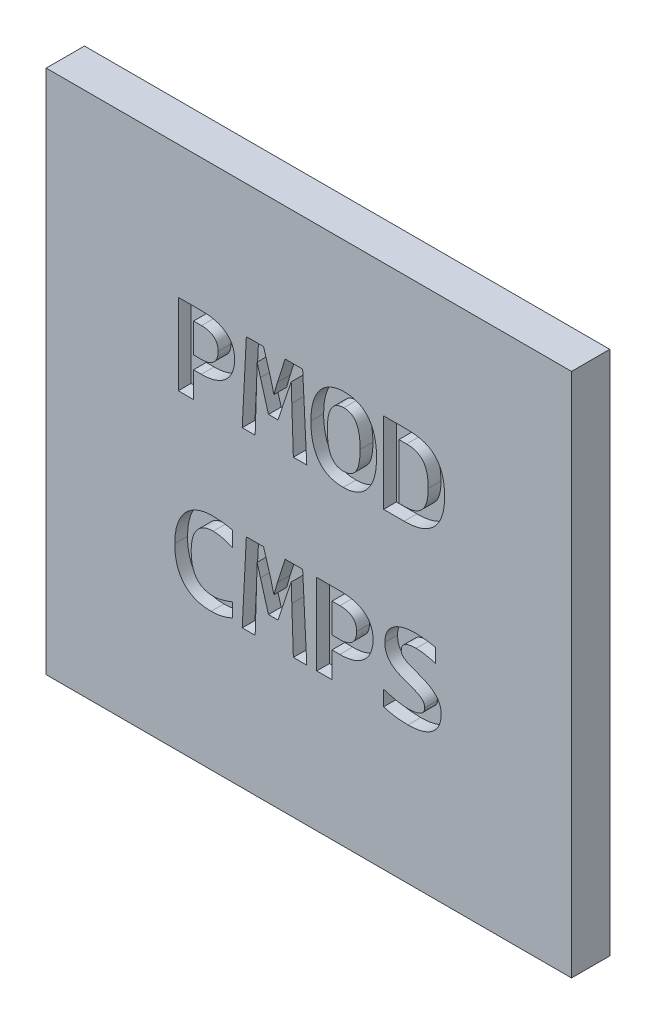
from build123d import *

# Parameters (mm, degrees)
SKETCH1_W           = 20.6
SKETCH1_H           = 20.6
BOSS_EXTRUDE1_DEPTH = 1.5
CUT_EXTRUDE1_DEPTH  = 0.5


with BuildPart() as part:
    # Sketch1 → Boss-Extrude1 (new body)
    with BuildSketch(Plane.XY):
        Rectangle(SKETCH1_W, SKETCH1_H)
    extrude(amount=BOSS_EXTRUDE1_DEPTH)

    # Sketch2 → Cut-Extrude1 (cut)
    # profile 1 of 8: a face of its own
    with BuildSketch(Plane.XY.offset(1.5)):
        with BuildLine():
            add(Edge.make_bspline(
                [(-2.912509351, 4.09115509), (-2.913370286, 4.050356398), (-2.915063486, 3.970117682), (-2.931577289, 3.852461334), (-2.957182348, 3.73942017), (-2.993980807, 3.631541868), (-3.040457289, 3.529506134), (-3.097062839, 3.434053925), (-3.164284862, 3.34614098), (-3.241547607, 3.265227882), (-3.328971358, 3.192191404), (-3.426972654, 3.128206505), (-3.534358037, 3.071727101), (-3.652134839, 3.025487032), (-3.779142916, 2.987319721), (-3.916666916, 2.962736718), (-4.063614226, 2.945105044), (-4.165147733, 2.943682505), (-4.217451606, 2.9429497)],
                knots=[0, 0, 0, 0, 0.995951848, 1.958736758, 2.895894734, 3.823294688, 4.737446986, 5.629902, 6.527868647, 7.434569106, 8.357172052, 9.30367983, 10.2881434, 11.315342456, 12.38959799, 13.521565949, 14.723261872, 16, 16, 16, 16], degree=3))
            Line((-4.217451606, 2.9429497), (-4.523016597, 2.9429497))
            Line((-4.523016597, 2.9429497), (-4.523016597, 1.93063086))
            Line((-4.523016597, 1.93063086), (-5.121205003, 1.93063086))
            Line((-5.121205003, 1.93063086), (-5.121205003, 5.10563086))
            Line((-5.121205003, 5.10563086), (-4.188692548, 5.10563086))
            add(Edge.make_bspline(
                [(-4.188692548, 5.10563086), (-4.138582372, 5.1047663), (-4.041321914, 5.103088249), (-3.89973554, 5.091182061), (-3.767398311, 5.069537545), (-3.643812671, 5.040186763), (-3.529162401, 5.00307623), (-3.424004781, 4.957775118), (-3.327838708, 4.905336836), (-3.24212565, 4.843751877), (-3.165274088, 4.77542748), (-3.09844419, 4.69907125), (-3.041398636, 4.615339112), (-2.994428709, 4.524037447), (-2.957700564, 4.425543399), (-2.931221289, 4.320213907), (-2.915030478, 4.207892453), (-2.913364563, 4.130754509), (-2.912509351, 4.09115509)],
                knots=[0, 0, 0, 0, 1.300129117, 2.523462549, 3.682710143, 4.776150495, 5.816367536, 6.80513186, 7.743083921, 8.652423492, 9.537522282, 10.405594958, 11.278287675, 12.15988475, 13.063059235, 13.999608658, 14.973082093, 16, 16, 16, 16], degree=3))
        make_face()
        with BuildLine():
            add(Edge.make_bspline(
                [(-3.556712249, 4.049454456), (-3.556964785, 4.069860158), (-3.557460031, 4.109877573), (-3.566115221, 4.168223855), (-3.577697613, 4.22409282), (-3.596004733, 4.276434461), (-3.618449919, 4.325841445), (-3.645160019, 4.372220135), (-3.679395985, 4.413106743), (-3.716466152, 4.451958644), (-3.760064446, 4.485645495), (-3.80874453, 4.515038392), (-3.862076617, 4.541494747), (-3.921543138, 4.561575839), (-3.985934275, 4.579481568), (-4.056292118, 4.591129101), (-4.132449972, 4.598554233), (-4.185078077, 4.599157854), (-4.212418771, 4.59947144)],
                knots=[0, 0, 0, 0, 1.004563121, 1.970038524, 2.901389421, 3.812754521, 4.695426961, 5.574536234, 6.43964924, 7.316613662, 8.216812953, 9.144562093, 10.116517752, 11.143806295, 12.232537793, 13.407305454, 14.653075798, 16, 16, 16, 16], degree=3))
            Line((-4.212418771, 4.59947144), (-4.523016597, 4.59947144))
            Line((-4.523016597, 4.59947144), (-4.523016597, 3.449109121))
            Line((-4.523016597, 3.449109121), (-4.193006407, 3.449109121))
            add(Edge.make_bspline(
                [(-4.193006407, 3.449109121), (-4.168059906, 3.449682742), (-4.119475983, 3.450799883), (-4.048788035, 3.458840753), (-3.9826058, 3.471579517), (-3.920782753, 3.489414442), (-3.864084495, 3.513261293), (-3.811898761, 3.541537894), (-3.763924925, 3.573711347), (-3.721432349, 3.611644614), (-3.683210878, 3.653223714), (-3.649913267, 3.699161409), (-3.620889941, 3.748536549), (-3.598260671, 3.802451889), (-3.579053014, 3.859228155), (-3.566627125, 3.919855077), (-3.558382997, 3.98356205), (-3.557278083, 4.02713862), (-3.556712249, 4.049454456)],
                knots=[0, 0, 0, 0, 1.207684678, 2.35199558, 3.439783558, 4.46788048, 5.461342384, 6.411506493, 7.338429375, 8.251005458, 9.162695831, 10.067864519, 10.993333631, 11.928859732, 12.893928183, 13.890772671, 14.919851382, 16, 16, 16, 16], degree=3))
        make_face(mode=Mode.SUBTRACT)
    # profile 2 of 8: a face of its own
    with BuildSketch(Plane.XY.offset(1.5)):
        Polygon((-0.608908807, 1.93063086), (-0.669302829, 3.730228912), (-0.692310075, 4.448486385), (-0.849046941, 3.990498387), (-1.210692095, 2.896935208), (-1.584559849, 2.896935208), (-1.898752557, 3.990498387), (-2.030325247, 4.448486385), (-2.049018635, 3.744608441), (-2.106536751, 1.93063086), (-2.613415148, 1.93063086), (-2.452364423, 5.10563086), (-1.777964514, 5.10563086), (-1.502596534, 4.191092816), (-1.371023843, 3.675586702), (-1.232980365, 4.161614782), (-0.93029128, 5.10563086), (-0.243668771, 5.10563086), (-0.082618046, 1.93063086), align=None)
    # profile 3 of 8: a face of its own
    with BuildSketch(Plane.XY.offset(1.5)):
        with BuildLine():
            add(Edge.make_bspline(
                [(2.655244273, 3.532510389), (2.654006971, 3.463208905), (2.651617448, 3.329371248), (2.633215003, 3.13577299), (2.601105268, 2.957090484), (2.556549013, 2.793076091), (2.501179835, 2.643738733), (2.436337795, 2.507975393), (2.361744164, 2.385998817), (2.277207333, 2.277938407), (2.1835727, 2.184241701), (2.083576471, 2.101899685), (1.974461879, 2.034083532), (1.858690431, 1.978735298), (1.737079924, 1.936256016), (1.61064822, 1.907327057), (1.480588115, 1.887408834), (1.392078402, 1.885552746), (1.347426111, 1.884616367)],
                knots=[0, 0, 0, 0, 1.399094986, 2.701985343, 3.921606295, 5.060250114, 6.128937938, 7.133140352, 8.093336986, 9.010033534, 9.896223585, 10.76303321, 11.619598843, 12.483160966, 13.349322064, 14.214333538, 15.099148625, 16, 16, 16, 16], degree=3))
            add(Edge.make_bspline(
                [(1.347426111, 1.884616367), (1.296312288, 1.885773477), (1.197049657, 1.888020576), (1.053005714, 1.907846918), (0.91863449, 1.939798961), (0.793970756, 1.985137452), (0.679290009, 2.043880799), (0.57421162, 2.115353442), (0.47929809, 2.200484269), (0.394169791, 2.298085665), (0.319090976, 2.408235276), (0.254519443, 2.530425925), (0.199657945, 2.664317883), (0.155851739, 2.809920605), (0.120046473, 2.966672796), (0.096706882, 3.135315298), (0.080993218, 3.315560919), (0.079303817, 3.439725838), (0.078432678, 3.503751331)],
                knots=[0, 0, 0, 0, 1.046182631, 2.031678192, 2.97076483, 3.86965419, 4.740954983, 5.602542005, 6.464464361, 7.344346083, 8.248138063, 9.187737429, 10.169205071, 11.206116273, 12.297806163, 13.458167033, 14.68930686, 16, 16, 16, 16], degree=3))
            add(Edge.make_bspline(
                [(0.078432678, 3.503751331), (0.079651524, 3.573055667), (0.082005406, 3.706898833), (0.100629108, 3.900181438), (0.131808137, 4.078725402), (0.176199678, 4.242647511), (0.232857607, 4.391796166), (0.297084584, 4.528164365), (0.371967564, 4.65024838), (0.456462745, 4.758323057), (0.550099136, 4.852034108), (0.650126803, 4.934307471), (0.759028147, 5.002326277), (0.875172585, 5.056679528), (0.996889098, 5.099249292), (1.12319788, 5.12897738), (1.253329784, 5.148857997), (1.341599743, 5.150709019), (1.38625084, 5.151645353)],
                knots=[0, 0, 0, 0, 1.399147349, 2.702086469, 3.916134137, 5.054820572, 6.125245074, 7.133847534, 8.094080105, 9.010810961, 9.897034179, 10.763876246, 11.620473937, 12.481991629, 13.348185144, 14.219056267, 15.099114909, 16, 16, 16, 16], degree=3))
            add(Edge.make_bspline(
                [(1.38625084, 5.151645353), (1.437364407, 5.150487868), (1.536626542, 5.148240041), (1.680673989, 5.128418835), (1.81503284, 5.096448658), (1.939740023, 5.051173844), (2.054145385, 4.992264558), (2.159693248, 4.921722472), (2.254337576, 4.836442266), (2.339543145, 4.738922864), (2.414360992, 4.628862885), (2.479378338, 4.507148999), (2.53382312, 4.373553373), (2.578079946, 4.228091533), (2.613581701, 4.071006831), (2.636981368, 3.90166703), (2.65265814, 3.720937382), (2.654365543, 3.596535102), (2.655244273, 3.532510389)],
                knots=[0, 0, 0, 0, 1.04600235, 2.031328089, 2.970252902, 3.868987364, 4.740138012, 5.59881955, 6.460593378, 7.340323477, 8.243959714, 9.179069388, 10.160367901, 11.192410958, 12.288699193, 13.453715767, 14.689532722, 16, 16, 16, 16], degree=3))
        make_face()
        with BuildLine():
            add(Edge.make_bspline(
                [(2.011041374, 3.503751331), (2.010730344, 3.548340029), (2.010127908, 3.634704133), (2.002587562, 3.75988876), (1.991619204, 3.876322708), (1.975199383, 3.983905304), (1.953686604, 4.082577993), (1.927904787, 4.172690034), (1.898268628, 4.25437226), (1.862546829, 4.326955072), (1.822848384, 4.391833704), (1.775240984, 4.447305549), (1.721664386, 4.493999212), (1.663037783, 4.533873017), (1.597232604, 4.563367903), (1.52551661, 4.583809012), (1.448101034, 4.597251349), (1.394457883, 4.598716878), (1.366838476, 4.59947144)],
                knots=[0, 0, 0, 0, 1.486095503, 2.8784268, 4.178896477, 5.383313849, 6.50370181, 7.542880676, 8.505944191, 9.395566462, 10.23559869, 11.034510805, 11.821349203, 12.599050339, 13.389126436, 14.213243526, 15.080047443, 16, 16, 16, 16], degree=3))
            add(Edge.make_bspline(
                [(1.366838476, 4.59947144), (1.339226129, 4.598694576), (1.285833118, 4.597192381), (1.208639611, 4.58415821), (1.137718143, 4.561919829), (1.073139937, 4.530751299), (1.014558072, 4.491248333), (0.961927298, 4.4432401), (0.914003646, 4.387294442), (0.871687619, 4.322984951), (0.834903717, 4.250599053), (0.804500403, 4.170060803), (0.777536023, 4.082319562), (0.757307353, 3.986480587), (0.741395916, 3.88350739), (0.731310152, 3.773035791), (0.723509595, 3.655325973), (0.722932444, 3.57422567), (0.722635577, 3.532510389)],
                knots=[0, 0, 0, 0, 0.940493395, 1.818598556, 2.65806311, 3.465325826, 4.253609174, 5.057352584, 5.885618443, 6.757702066, 7.674492596, 8.646685703, 9.687886232, 10.799631583, 11.981266591, 13.236822997, 14.578714251, 16, 16, 16, 16], degree=3))
            add(Edge.make_bspline(
                [(0.722635577, 3.532510389), (0.722970633, 3.487923917), (0.723619604, 3.401564128), (0.730836336, 3.276325119), (0.74292184, 3.159970313), (0.759465111, 3.052225187), (0.779804501, 2.953135665), (0.805376857, 2.862830178), (0.836761785, 2.781792762), (0.871187136, 2.70853793), (0.912832798, 2.644478754), (0.959583814, 2.58855348), (1.012670058, 2.54100366), (1.072232213, 2.502741328), (1.137625208, 2.472944967), (1.208877408, 2.452453432), (1.28580576, 2.438966109), (1.339216803, 2.437531956), (1.366838476, 2.43679028)],
                knots=[0, 0, 0, 0, 1.486662466, 2.879524953, 4.181300558, 5.38617743, 6.513130284, 7.552705609, 8.511484829, 9.408629925, 10.246547046, 11.051854149, 11.833006184, 12.613299248, 13.403676768, 14.220441868, 15.079696471, 16, 16, 16, 16], degree=3))
            add(Edge.make_bspline(
                [(1.366838476, 2.43679028), (1.394444582, 2.437591867), (1.4480619, 2.43914873), (1.525570905, 2.451932253), (1.596452366, 2.474562746), (1.661818967, 2.504687771), (1.720227178, 2.545182992), (1.773936477, 2.592508058), (1.82102363, 2.649092978), (1.862850943, 2.713248423), (1.89835764, 2.786045201), (1.930431417, 2.865536739), (1.954949799, 2.953750323), (1.975948114, 3.049233744), (1.991207465, 3.152588487), (2.002672082, 3.26316717), (2.010083094, 3.380945261), (2.010715887, 3.462039281), (2.011041374, 3.503751331)],
                knots=[0, 0, 0, 0, 0.940029382, 1.82575022, 2.664800606, 3.468147471, 4.267377886, 5.076798435, 5.899366548, 6.766536204, 7.679194691, 8.653886611, 9.682108903, 10.79330575, 11.982426563, 13.238186273, 14.579415474, 16, 16, 16, 16], degree=3))
        make_face(mode=Mode.SUBTRACT)
    # profile 4 of 8: a face of its own
    with BuildSketch(Plane.XY.offset(1.5)):
        with BuildLine():
            add(Edge.make_bspline(
                [(5.324084852, 3.558393541), (5.323061463, 3.498190937), (5.321059209, 3.380404881), (5.303016709, 3.207981482), (5.275962761, 3.043798182), (5.235370702, 2.888728295), (5.184214305, 2.743206366), (5.120119976, 2.607988643), (5.041776688, 2.484658251), (4.951860536, 2.371562298), (4.848077612, 2.270685515), (4.730372164, 2.182588655), (4.599421608, 2.106114714), (4.45486354, 2.041966355), (4.296040993, 1.99145556), (4.122525189, 1.956149995), (3.934139655, 1.934362242), (3.803512083, 1.931903917), (3.735865876, 1.93063086)],
                knots=[0, 0, 0, 0, 1.110427075, 2.172544315, 3.195349749, 4.177748535, 5.125988168, 6.037741059, 6.932042727, 7.815964876, 8.69777207, 9.594508137, 10.521994162, 11.48995721, 12.506588634, 13.59059811, 14.752277985, 16, 16, 16, 16], degree=3))
            Line((3.735865876, 1.93063086), (2.931331229, 1.93063086))
            Line((2.931331229, 1.93063086), (2.931331229, 5.10563086))
            Line((2.931331229, 5.10563086), (3.869595495, 5.10563086))
            add(Edge.make_bspline(
                [(3.869595495, 5.10563086), (3.928362709, 5.104631119), (4.042330699, 5.102692308), (4.207612222, 5.084777082), (4.361851113, 5.057849253), (4.504584802, 5.017226438), (4.636021863, 4.965579706), (4.757010671, 4.90244833), (4.865177751, 4.824733959), (4.962462955, 4.735449726), (5.049214699, 4.634195834), (5.122109591, 4.51852919), (5.185268903, 4.391240016), (5.235754816, 4.250658712), (5.276532132, 4.097319866), (5.303359885, 3.92990398), (5.321193525, 3.748829099), (5.323098057, 3.623388202), (5.324084852, 3.558393541)],
                knots=[0, 0, 0, 0, 1.153278946, 2.236568238, 3.259968389, 4.223524422, 5.144358991, 6.028301925, 6.89516473, 7.750925641, 8.615384892, 9.504135122, 10.427813762, 11.399741143, 12.431359603, 13.538177242, 14.724456375, 16, 16, 16, 16], degree=3))
        make_face()
        with BuildLine():
            add(Edge.make_bspline(
                [(4.679881954, 3.519568813), (4.679216419, 3.561037321), (4.677918971, 3.641879505), (4.67114753, 3.759751859), (4.658115991, 3.870615215), (4.640360236, 3.974404749), (4.617301694, 4.071475236), (4.585612735, 4.160485346), (4.547316614, 4.242045431), (4.502031168, 4.316036825), (4.448594925, 4.382044289), (4.386587353, 4.439582331), (4.316411355, 4.488622968), (4.237666637, 4.529371678), (4.149646978, 4.560950915), (4.052219328, 4.583668247), (3.944763129, 4.597460834), (3.869878791, 4.598781649), (3.830770767, 4.59947144)],
                knots=[0, 0, 0, 0, 1.255554051, 2.44768226, 3.572651082, 4.633086061, 5.634384971, 6.589040905, 7.488061995, 8.357917203, 9.208928104, 10.050890238, 10.910395455, 11.793077134, 12.727247796, 13.733895114, 14.81653645, 16, 16, 16, 16], degree=3))
            Line((3.830770767, 4.59947144), (3.529519635, 4.59947144))
            Line((3.529519635, 4.59947144), (3.529519635, 2.43679028))
            Line((3.529519635, 2.43679028), (3.78978911, 2.43679028))
            add(Edge.make_bspline(
                [(3.78978911, 2.43679028), (3.825058221, 2.437616247), (3.893659637, 2.439222823), (3.993254594, 2.451720687), (4.086632992, 2.471380608), (4.173319963, 2.500397049), (4.253597776, 2.536884363), (4.327185431, 2.582112499), (4.394242715, 2.635293679), (4.45444761, 2.69725702), (4.50848719, 2.767575353), (4.553863311, 2.848119096), (4.594039987, 2.936875458), (4.625027653, 3.035778756), (4.650405437, 3.143357977), (4.66689669, 3.26081339), (4.678050429, 3.387060837), (4.679258824, 3.474486296), (4.679881954, 3.519568813)],
                knots=[0, 0, 0, 0, 1.054031268, 2.050180318, 2.995897094, 3.902119281, 4.777280808, 5.626335315, 6.477804485, 7.328942045, 8.203017891, 9.120973329, 10.086270126, 11.110341295, 12.2138552, 13.387141734, 14.65263243, 16, 16, 16, 16], degree=3))
        make_face(mode=Mode.SUBTRACT)
    # profile 5 of 8: a face of its own
    with BuildSketch(Plane.XY.offset(1.5)):
        with BuildLine():
            add(Edge.make_bspline(
                [(-3.004538336, -4.729151749), (-3.039625175, -4.744129865), (-3.108464475, -4.77351647), (-3.212514945, -4.810775426), (-3.314666346, -4.842612079), (-3.415893974, -4.868656677), (-3.517310518, -4.88940034), (-3.620207657, -4.902372417), (-3.725022317, -4.911688822), (-3.795630639, -4.912698688), (-3.831361253, -4.91320972)],
                knots=[0, 0, 0, 0, 1.072602722, 2.104413604, 3.106297595, 4.08050826, 5.042709706, 6.014913564, 6.995467464, 8, 8, 8, 8], degree=3))
            add(Edge.make_bspline(
                [(-3.831361253, -4.91320972), (-3.887255583, -4.911986365), (-3.995777276, -4.90961116), (-4.153901359, -4.890660719), (-4.301970782, -4.859353509), (-4.44050999, -4.81564768), (-4.568492366, -4.75854102), (-4.686526041, -4.689210778), (-4.794388482, -4.607641448), (-4.891331835, -4.513390478), (-4.977526213, -4.407113638), (-5.051564655, -4.287853535), (-5.115759189, -4.157462077), (-5.168209549, -4.014769458), (-5.209022972, -3.860195327), (-5.23794179, -3.693742577), (-5.256429614, -3.515456711), (-5.258289668, -3.392622621), (-5.259248481, -3.329304602)],
                knots=[0, 0, 0, 0, 1.102605573, 2.140764961, 3.136846793, 4.08496906, 5.001529512, 5.896051515, 6.780328523, 7.66316301, 8.557497515, 9.473264751, 10.427030373, 11.420482266, 12.467702166, 13.577100782, 14.751053738, 16, 16, 16, 16], degree=3))
            add(Edge.make_bspline(
                [(-5.259248481, -3.329304602), (-5.258098137, -3.264301195), (-5.255855697, -3.137585796), (-5.235805739, -2.953306496), (-5.205091981, -2.77963151), (-5.159321648, -2.617714211), (-5.103021056, -2.466757899), (-5.034280148, -2.328349609), (-4.955989706, -2.201219352), (-4.865504873, -2.087098021), (-4.764602816, -1.98513347), (-4.652881485, -1.896262696), (-4.531703598, -1.819395407), (-4.39969912, -1.756814525), (-4.258675106, -1.707421675), (-4.108974788, -1.671127265), (-3.950580218, -1.650327605), (-3.842206542, -1.647583869), (-3.786784713, -1.646180734)],
                knots=[0, 0, 0, 0, 1.232307787, 2.402218284, 3.511138658, 4.573037126, 5.588482404, 6.562047137, 7.499038646, 8.414657469, 9.317692522, 10.213424542, 11.116219401, 12.033010505, 12.977368732, 13.94518829, 14.949178196, 16, 16, 16, 16], degree=3))
            add(Edge.make_bspline(
                [(-3.786784713, -1.646180734), (-3.751308801, -1.646148563), (-3.682493509, -1.646086159), (-3.581860312, -1.650486746), (-3.485338877, -1.654399448), (-3.390982014, -1.664741945), (-3.296790434, -1.676115688), (-3.201649345, -1.693896685), (-3.103599168, -1.71212174), (-3.037995599, -1.729398645), (-3.004538336, -1.73820972)],
                knots=[0, 0, 0, 0, 1.077376558, 2.089868288, 3.059369192, 4.010411707, 4.972009834, 5.940198088, 6.949518525, 8, 8, 8, 8], degree=3))
            Line((-3.004538336, -1.73820972), (-3.004538336, -2.336398126))
            add(Edge.make_bspline(
                [(-3.004538336, -2.336398126), (-3.038877214, -2.320651479), (-3.10611785, -2.2898172), (-3.207897791, -2.251387491), (-3.306693917, -2.218351547), (-3.403317097, -2.194485824), (-3.495879638, -2.175472048), (-3.584726001, -2.162642845), (-3.669193872, -2.15430181), (-3.724216209, -2.15297976), (-3.75083589, -2.152340155)],
                knots=[0, 0, 0, 0, 1.170030163, 2.291093263, 3.368831198, 4.395296508, 5.372370687, 6.295361994, 7.175300008, 8, 8, 8, 8], degree=3))
            add(Edge.make_bspline(
                [(-3.75083589, -2.152340155), (-3.787796523, -2.153242899), (-3.85917287, -2.154986231), (-3.962255306, -2.170150483), (-4.056991334, -2.195803994), (-4.143266199, -2.232142593), (-4.221794588, -2.277309234), (-4.293473153, -2.330420165), (-4.357019889, -2.393016916), (-4.413274831, -2.463124999), (-4.462459627, -2.540889456), (-4.504668334, -2.625740183), (-4.540115347, -2.717677009), (-4.567626336, -2.816273776), (-4.589209408, -2.920546606), (-4.603864347, -3.03012214), (-4.613691823, -3.144587495), (-4.614588347, -3.222634894), (-4.615045582, -3.262439792)],
                knots=[0, 0, 0, 0, 1.109729706, 2.143049175, 3.121026665, 4.050204485, 4.946654748, 5.836403406, 6.722153568, 7.618170183, 8.530804457, 9.480502004, 10.460411604, 11.48580219, 12.551706219, 13.656287425, 14.804684813, 16, 16, 16, 16], degree=3))
            add(Edge.make_bspline(
                [(-4.615045582, -3.262439792), (-4.614685238, -3.304408604), (-4.613981956, -3.386318728), (-4.602967756, -3.505492612), (-4.588841054, -3.618328061), (-4.566404181, -3.723783285), (-4.538128464, -3.82217773), (-4.501772241, -3.912491572), (-4.459686763, -3.99577519), (-4.409724328, -4.071029935), (-4.352835556, -4.138717778), (-4.287625476, -4.196991535), (-4.215485458, -4.247271686), (-4.135998951, -4.289300817), (-4.048413257, -4.32155119), (-3.953304149, -4.344170648), (-3.850770379, -4.359190303), (-3.779651677, -4.360407346), (-3.742927149, -4.361035807)],
                knots=[0, 0, 0, 0, 1.256876421, 2.453033611, 3.583260076, 4.661975506, 5.679853963, 6.646528144, 7.574590913, 8.470745685, 9.346915849, 10.216322401, 11.082788599, 11.975686973, 12.902638023, 13.870910894, 14.900573425, 16, 16, 16, 16], degree=3))
            add(Edge.make_bspline(
                [(-3.742927149, -4.361035807), (-3.71461084, -4.360345382), (-3.655605136, -4.35890667), (-3.564658327, -4.346390898), (-3.470021787, -4.328535987), (-3.373261076, -4.306306782), (-3.276836379, -4.279103988), (-3.181972943, -4.247555534), (-3.091109498, -4.213636339), (-3.032738067, -4.188918994), (-3.004538336, -4.176977836)],
                knots=[0, 0, 0, 0, 0.887372101, 1.849111607, 2.873273884, 3.906654629, 4.960374994, 6.012916101, 7.040022999, 8, 8, 8, 8], degree=3))
            Line((-3.004538336, -4.176977836), (-3.004538336, -4.729151749))
        make_face()
    # profile 6 of 8: a face of its own
    with BuildSketch(Plane.XY.offset(1.5)):
        Polygon((-0.608908807, -4.867195227), (-0.669302829, -3.067597175), (-0.692310075, -2.349339702), (-0.849046941, -2.8073277), (-1.210692095, -3.900890879), (-1.584559849, -3.900890879), (-1.898752557, -2.8073277), (-2.030325247, -2.349339702), (-2.049018635, -3.053217646), (-2.106536751, -4.867195227), (-2.613415148, -4.867195227), (-2.452364423, -1.692195227), (-1.777964514, -1.692195227), (-1.502596534, -2.606733271), (-1.371023843, -3.122239385), (-1.232980365, -2.636211305), (-0.93029128, -1.692195227), (-0.243668771, -1.692195227), (-0.082618046, -4.867195227), align=None)
    # profile 7 of 8: a face of its own
    with BuildSketch(Plane.XY.offset(1.5)):
        with BuildLine():
            add(Edge.make_bspline(
                [(2.517200794, -2.706670997), (2.516339859, -2.747469689), (2.514646659, -2.827708405), (2.498132856, -2.945364753), (2.472527797, -3.058405917), (2.435729338, -3.166284219), (2.389252856, -3.268319953), (2.332647306, -3.363772162), (2.265425283, -3.451685107), (2.188162537, -3.532598205), (2.100738787, -3.605634683), (2.002737491, -3.669619582), (1.895352108, -3.726098986), (1.777575305, -3.772339055), (1.650567229, -3.810506366), (1.513043229, -3.835089369), (1.366095919, -3.852721043), (1.264562412, -3.854143582), (1.212258539, -3.854876387)],
                knots=[0, 0, 0, 0, 0.995951848, 1.958736758, 2.895894734, 3.823294688, 4.737446986, 5.629902, 6.527868647, 7.434569106, 8.357172052, 9.30367983, 10.2881434, 11.315342456, 12.38959799, 13.521565949, 14.723261872, 16, 16, 16, 16], degree=3))
            Line((1.212258539, -3.854876387), (0.906693548, -3.854876387))
            Line((0.906693548, -3.854876387), (0.906693548, -4.867195227))
            Line((0.906693548, -4.867195227), (0.308505142, -4.867195227))
            Line((0.308505142, -4.867195227), (0.308505142, -1.692195227))
            Line((0.308505142, -1.692195227), (1.241017597, -1.692195227))
            add(Edge.make_bspline(
                [(1.241017597, -1.692195227), (1.291127773, -1.693059787), (1.388388231, -1.694737838), (1.529974604, -1.706644026), (1.662311834, -1.728288542), (1.785897474, -1.757639324), (1.900547743, -1.794749857), (2.005705364, -1.840050969), (2.101871436, -1.892489251), (2.187584495, -1.95407421), (2.264436057, -2.022398607), (2.331265955, -2.098754837), (2.388311509, -2.182486975), (2.435281436, -2.27378864), (2.472009581, -2.372282688), (2.498488856, -2.47761218), (2.514679666, -2.589933634), (2.516345582, -2.667071578), (2.517200794, -2.706670997)],
                knots=[0, 0, 0, 0, 1.300129117, 2.523462549, 3.682710143, 4.776150495, 5.816367536, 6.80513186, 7.743083921, 8.652423492, 9.537522282, 10.405594958, 11.278287675, 12.15988475, 13.063059235, 13.999608658, 14.973082093, 16, 16, 16, 16], degree=3))
        make_face()
        with BuildLine():
            add(Edge.make_bspline(
                [(1.872997896, -2.748371631), (1.87274536, -2.727965929), (1.872250114, -2.687948514), (1.863594924, -2.629602232), (1.852012532, -2.573733267), (1.833705412, -2.521391626), (1.811260226, -2.471984642), (1.784550125, -2.425605952), (1.75031416, -2.384719344), (1.713243993, -2.345867443), (1.669645699, -2.312180592), (1.620965615, -2.282787695), (1.567633528, -2.25633134), (1.508167007, -2.236250248), (1.44377587, -2.218344519), (1.373418027, -2.206696986), (1.297260173, -2.199271854), (1.244632068, -2.198668233), (1.217291374, -2.198354647)],
                knots=[0, 0, 0, 0, 1.004563121, 1.970038524, 2.901389421, 3.812754521, 4.695426961, 5.574536234, 6.43964924, 7.316613662, 8.216812953, 9.144562093, 10.116517752, 11.143806295, 12.232537793, 13.407305454, 14.653075798, 16, 16, 16, 16], degree=3))
            Line((1.217291374, -2.198354647), (0.906693548, -2.198354647))
            Line((0.906693548, -2.198354647), (0.906693548, -3.348716966))
            Line((0.906693548, -3.348716966), (1.236703738, -3.348716966))
            add(Edge.make_bspline(
                [(1.236703738, -3.348716966), (1.261650239, -3.348143345), (1.310234162, -3.347026204), (1.38092211, -3.338985334), (1.447104345, -3.32624657), (1.508927392, -3.308411645), (1.56562565, -3.284564794), (1.617811384, -3.256288193), (1.66578522, -3.22411474), (1.708277796, -3.186181472), (1.746499267, -3.144602373), (1.779796878, -3.098664677), (1.808820203, -3.049289538), (1.831449474, -2.995374198), (1.850657131, -2.938597932), (1.86308302, -2.87797101), (1.871327148, -2.814264037), (1.872432062, -2.770687467), (1.872997896, -2.748371631)],
                knots=[0, 0, 0, 0, 1.207684678, 2.35199558, 3.439783558, 4.46788048, 5.461342384, 6.411506493, 7.338429375, 8.251005458, 9.162695831, 10.067864519, 10.993333631, 11.928859732, 12.893928183, 13.890772671, 14.919851382, 16, 16, 16, 16], degree=3))
        make_face(mode=Mode.SUBTRACT)
    # profile 8 of 8: a face of its own
    with BuildSketch(Plane.XY.offset(1.5)):
        with BuildLine():
            add(Edge.make_bspline(
                [(5.186041374, -3.903047809), (5.185158671, -3.944833165), (5.183444503, -4.02597841), (5.163808053, -4.143319874), (5.134292186, -4.252713638), (5.091406796, -4.353288758), (5.037865899, -4.445023657), (4.974748062, -4.528662661), (4.901793963, -4.603752621), (4.819087562, -4.670028721), (4.727942511, -4.728464426), (4.628484984, -4.778882082), (4.520347122, -4.820377983), (4.404952261, -4.85467312), (4.282590614, -4.881172602), (4.154267425, -4.899427601), (4.020331029, -4.911458577), (3.9290579, -4.912618514), (3.882537072, -4.91320972)],
                knots=[0, 0, 0, 0, 1.073681499, 2.085040185, 3.051149047, 3.981944283, 4.887978953, 5.776845786, 6.670466122, 7.573455289, 8.49677068, 9.450589821, 10.436166866, 11.471749255, 12.544173733, 13.653021529, 14.803772988, 16, 16, 16, 16], degree=3))
            add(Edge.make_bspline(
                [(3.882537072, -4.91320972), (3.800040068, -4.911686013), (3.63733387, -4.908680853), (3.396588753, -4.884931956), (3.160830261, -4.842270692), (3.008160773, -4.797630843), (2.931331229, -4.775166242)],
                knots=[0, 0, 0, 0, 1.025764599, 2.023082686, 3.005134181, 4, 4, 4, 4], degree=3))
            Line((2.931331229, -4.775166242), (2.931331229, -4.176977836))
            add(Edge.make_bspline(
                [(2.931331229, -4.176977836), (2.970115136, -4.189326446), (3.048861696, -4.214398973), (3.168859092, -4.250002504), (3.292123393, -4.280191598), (3.416129092, -4.307974136), (3.540418183, -4.330039172), (3.663840056, -4.34756296), (3.785267031, -4.358842734), (3.865498624, -4.360314432), (3.904825341, -4.361035807)],
                knots=[0, 0, 0, 0, 0.982138956, 1.994127776, 3.019379675, 4.043652595, 5.060010385, 6.064286964, 7.051181246, 8, 8, 8, 8], degree=3))
            add(Edge.make_bspline(
                [(3.904825341, -4.361035807), (3.932633417, -4.360839422), (3.985903883, -4.360463218), (4.062717657, -4.355421305), (4.132775598, -4.346848008), (4.197003379, -4.335571825), (4.254770676, -4.320398297), (4.307307235, -4.303271108), (4.353920187, -4.283174424), (4.395589463, -4.26093899), (4.431298577, -4.235788341), (4.462400252, -4.20897315), (4.487657555, -4.179259324), (4.514578817, -4.13703478), (4.537082021, -4.077648227), (4.540237052, -4.027646374), (4.541838476, -4.002266559)],
                knots=[0, 0, 0, 0, 1.428616996, 2.73672639, 3.952495327, 5.053878092, 6.0842745, 7.018828766, 7.890331589, 8.689308687, 9.440856164, 10.130100935, 10.793906804, 11.436117796, 12.698631087, 14, 14, 14, 14], degree=3))
            add(Edge.make_bspline(
                [(4.541838476, -4.002266559), (4.54097272, -3.983755715), (4.539288586, -3.947747027), (4.52726038, -3.895751021), (4.504966649, -3.849001743), (4.474959279, -3.806949135), (4.437973862, -3.768873837), (4.396811997, -3.731853804), (4.348427147, -3.699263751), (4.277051243, -3.656035879), (4.176077599, -3.607676337), (4.043398245, -3.558858469), (3.902884438, -3.509569654), (3.75840033, -3.457457509), (3.614601358, -3.397495902), (3.495655576, -3.343855375), (3.404167857, -3.29436599), (3.339583584, -3.252691825), (3.278729317, -3.206852713), (3.220993424, -3.157717692), (3.168282598, -3.102975364), (3.12162922, -3.042867666), (3.079439281, -2.978365526), (3.042560714, -2.908653659), (3.012401576, -2.832222112), (2.992096786, -2.748533421), (2.979736617, -2.657670475), (2.978162654, -2.594792288), (2.977345722, -2.562156731)],
                knots=[0, 0, 0, 0, 0.628577789, 1.222756944, 1.798018064, 2.376093337, 2.969100815, 3.597678604, 4.252424917, 4.946124793, 6.431204757, 8.043936516, 9.745465074, 11.488681512, 13.25853968, 15.035457213, 15.916880054, 16.788288763, 17.642849837, 18.502665518, 19.360321436, 20.218324825, 21.082903639, 21.974822425, 22.892221362, 23.865363472, 24.892063288, 26, 26, 26, 26], degree=3))
            add(Edge.make_bspline(
                [(2.977345722, -2.562156731), (2.97812924, -2.531428095), (2.979678904, -2.470652085), (2.993439999, -2.380953255), (3.013831944, -2.293303854), (3.044210878, -2.208785325), (3.082771601, -2.127456146), (3.132339157, -2.051751877), (3.190754194, -1.980653346), (3.259793124, -1.915752524), (3.338527018, -1.856497661), (3.427834591, -1.804228428), (3.526673527, -1.757051472), (3.636630252, -1.71799607), (3.757320615, -1.685003423), (3.890049933, -1.663034977), (4.03437282, -1.647953855), (4.134614761, -1.646786743), (4.18666411, -1.646180734)],
                knots=[0, 0, 0, 0, 0.86106195, 1.703033948, 2.539139973, 3.380790137, 4.216301896, 5.056905248, 5.911254958, 6.790607679, 7.707171391, 8.668295362, 9.687250551, 10.773449095, 11.935660323, 13.190638171, 14.54127474, 16, 16, 16, 16], degree=3))
            add(Edge.make_bspline(
                [(4.18666411, -1.646180734), (4.219026725, -1.646653517), (4.285236299, -1.647620766), (4.385672759, -1.653787652), (4.487591316, -1.66209739), (4.588710084, -1.673834764), (4.687532448, -1.687156672), (4.782325032, -1.703295844), (4.871709501, -1.719033127), (4.928691835, -1.732001732), (4.95596891, -1.73820972)],
                knots=[0, 0, 0, 0, 1.000632186, 2.047159369, 3.110551158, 4.162103459, 5.194366354, 6.193323381, 7.135155576, 8, 8, 8, 8], degree=3))
            Line((4.95596891, -1.73820972), (4.95596891, -2.290383633))
            add(Edge.make_bspline(
                [(4.95596891, -2.290383633), (4.928740502, -2.280518042), (4.87234804, -2.260085523), (4.783895372, -2.234220009), (4.690472708, -2.210210162), (4.593451759, -2.19061012), (4.494472412, -2.173786363), (4.395599045, -2.162070529), (4.298979709, -2.153302039), (4.23557314, -2.152655558), (4.204638521, -2.152340155)],
                knots=[0, 0, 0, 0, 0.905300762, 1.874958649, 2.879989676, 3.920459461, 4.968805495, 6.018141936, 7.033096622, 8, 8, 8, 8], degree=3))
            add(Edge.make_bspline(
                [(4.204638521, -2.152340155), (4.179222877, -2.152517954), (4.130254076, -2.152860522), (4.059976438, -2.158185605), (3.995519102, -2.165561033), (3.93731658, -2.177431848), (3.8842967, -2.190728997), (3.836815048, -2.207426877), (3.793775349, -2.225988054), (3.755837576, -2.247601133), (3.722092741, -2.270949675), (3.694536534, -2.298552129), (3.670446916, -2.32742243), (3.646692444, -2.370536109), (3.625589253, -2.429961677), (3.622921234, -2.480220136), (3.62154862, -2.506076568)],
                knots=[0, 0, 0, 0, 1.388230333, 2.674729552, 3.848979118, 4.930101904, 5.917823404, 6.833012122, 7.677256906, 8.474713018, 9.216010271, 9.910495862, 10.599653, 11.262301414, 12.591538262, 14, 14, 14, 14], degree=3))
            add(Edge.make_bspline(
                [(3.62154862, -2.506076568), (3.622365325, -2.522220397), (3.623950855, -2.553561631), (3.636777103, -2.598790944), (3.657821784, -2.640464493), (3.688152662, -2.677781805), (3.724748796, -2.712258846), (3.766433494, -2.745500238), (3.814252121, -2.77606913), (3.886027859, -2.816340523), (3.987213545, -2.861746706), (4.118751913, -2.912787366), (4.260185197, -2.961546903), (4.404543319, -3.017040388), (4.549843561, -3.076037909), (4.667627556, -3.133647126), (4.759269217, -3.183730538), (4.823806595, -3.226206326), (4.884713183, -3.272697276), (4.941996292, -3.322540741), (4.995063258, -3.376780726), (5.042738963, -3.435845034), (5.084334955, -3.500087483), (5.120762526, -3.568896207), (5.150627388, -3.643106375), (5.171442956, -3.724028809), (5.183559034, -3.811368609), (5.185196728, -3.871852854), (5.186041374, -3.903047809)],
                knots=[0, 0, 0, 0, 0.557156268, 1.081649532, 1.611348813, 2.159818371, 2.733894156, 3.347031838, 3.999468898, 4.692937397, 6.19005387, 7.82657883, 9.568786128, 11.359307707, 13.171290529, 14.986394118, 15.88741221, 16.778746798, 17.653416553, 18.53387112, 19.400741367, 20.27258301, 21.152453011, 22.041629961, 22.959843454, 23.910073311, 24.922113205, 26, 26, 26, 26], degree=3))
        make_face()
    extrude(amount=-CUT_EXTRUDE1_DEPTH, mode=Mode.SUBTRACT)


solid = part.part
